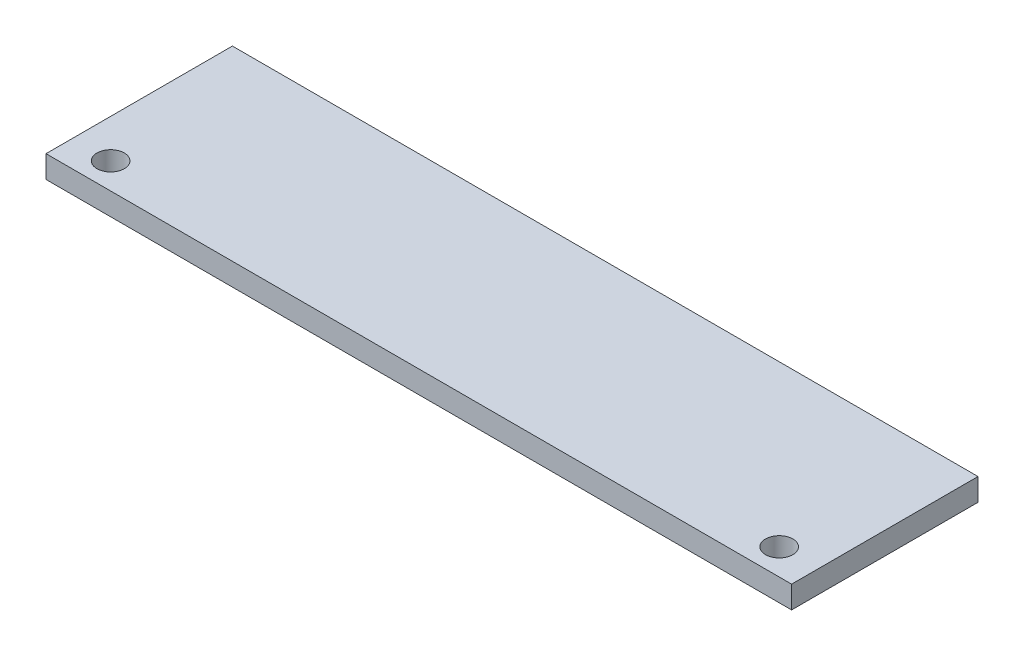
from build123d import *

# Parameters (mm, degrees)
ESQUISSE1_W             = 600
ESQUISSE1_H             = 150
BOSS_EXTRU_1_DEPTH      = 18
ESQUISSE3_R             = 11
ENL_V_MAT_EXTRU_1_DEPTH = 20


with BuildPart() as part:
    # Esquisse1 → Boss.-Extru.1 (new body)
    with BuildSketch(Plane(origin=(0, 0, 0), x_dir=(1, 0, 0), z_dir=(0, 1, 0))):
        Rectangle(ESQUISSE1_W, ESQUISSE1_H)
    extrude(amount=BOSS_EXTRU_1_DEPTH)

    # Esquisse3 → Enlèv. mat.-Extru.1 (cut)
    with BuildSketch(Plane(origin=(0, 18, 0), x_dir=(1, 0, 0), z_dir=(0, 1, 0))):
        with Locations(Location((269, -54, 0), (0, 0, 270))):
            Circle(ESQUISSE3_R)
        with Locations(Location((-269, -54, 0), (0, 0, 270))):
            Circle(ESQUISSE3_R)
    extrude(amount=-ENL_V_MAT_EXTRU_1_DEPTH, mode=Mode.SUBTRACT)


solid = part.part
